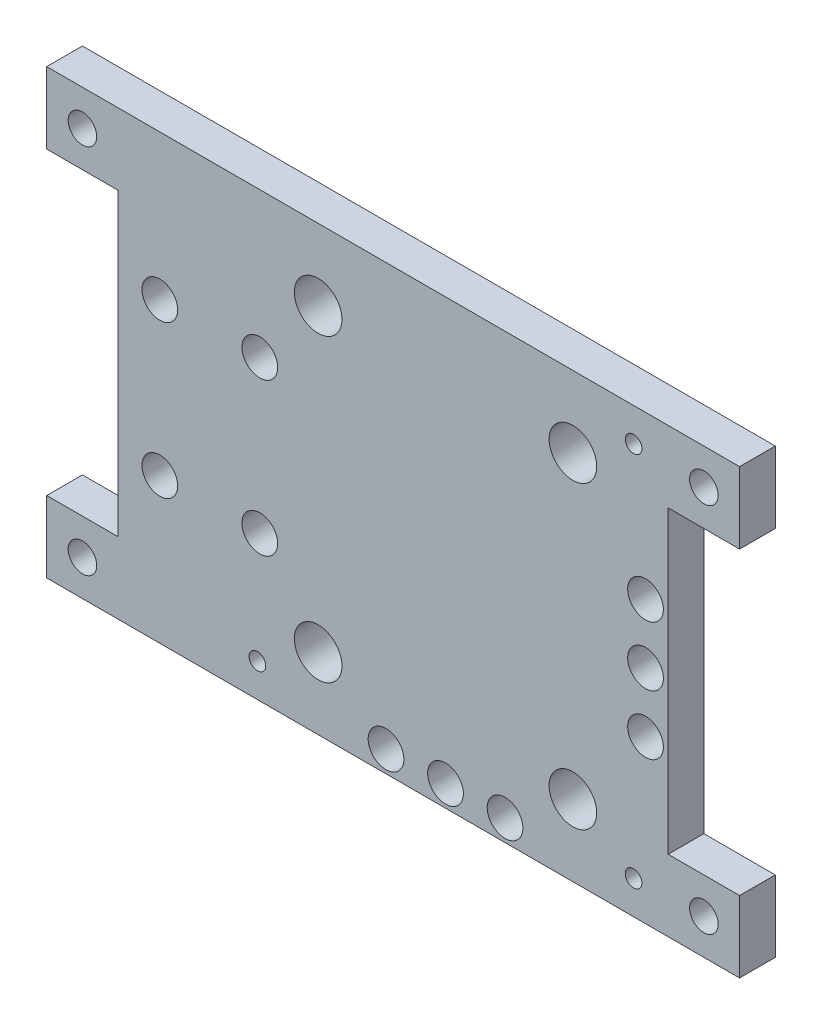
from build123d import *

# Parameters (mm, degrees)
SKETCH_1_W          = 23.1
SKETCH_1_H          = 18.6
EXTRUDE_1_DEPTH     = 1.5
SKETCH_2_R          = 0.75
SKETCH_2_R_2        = 1
SKETCH_2_R_3        = 0.35
CUT_EXTRUDE_1_DEPTH = 15.904445646
SKETCH_3_W          = 3
SKETCH_3_H          = 3
SKETCH_3_R          = 0.6
EXTRUDE_2_DEPTH     = 1.5


with BuildPart() as part:
    # 草图1 → 凸台-拉伸1 (new body)
    with BuildSketch(Plane.XY):
        Rectangle(SKETCH_1_W, SKETCH_1_H)
    extrude(amount=EXTRUDE_1_DEPTH)

    # 草图2 → 切除-拉伸1 (cut, through all)
    with BuildSketch(Plane(origin=(0, 0, 0), x_dir=(-1, 0, 0), z_dir=(0, 0, -1))):
        with Locations((-10.6, 2.5)):
            Circle(SKETCH_2_R)
        with Locations((-10.6, 0)):
            Circle(SKETCH_2_R)
        with Locations((-10.6, -2.5)):
            Circle(SKETCH_2_R)
        with Locations((-7.55, -6.3)):
            Circle(SKETCH_2_R_2)
        with Locations((3.15, -6.3)):
            Circle(SKETCH_2_R_2)
        with Locations((-4.7, -8.4)):
            Circle(SKETCH_2_R)
        with Locations((-2.2, -8.4)):
            Circle(SKETCH_2_R)
        with Locations((0.3, -8.4)):
            Circle(SKETCH_2_R)
        with Locations((-7.55, 6.3)):
            Circle(SKETCH_2_R_2)
        with Locations((3.15, 6.3)):
            Circle(SKETCH_2_R_2)
        with Locations((5.6, 3.2)):
            Circle(SKETCH_2_R)
        with Locations((9.8, 3.2)):
            Circle(SKETCH_2_R)
        with Locations((5.6, -3.2)):
            Circle(SKETCH_2_R)
        with Locations((9.8, -3.2)):
            Circle(SKETCH_2_R)
        with Locations((5.7, -7.9)):
            Circle(SKETCH_2_R_3)
        with Locations((-10.1, -7.9)):
            Circle(SKETCH_2_R_3)
        with Locations((-10.1, 7.9)):
            Circle(SKETCH_2_R_3)
    extrude(amount=-CUT_EXTRUDE_1_DEPTH, mode=Mode.SUBTRACT)

    # 草图3 → 凸台-拉伸2 (add)
    # profile 1 of 4: a face of its own
    with BuildSketch(Plane(origin=(0, 0, 0), x_dir=(-1, 0, 0), z_dir=(0, 0, -1))):
        with Locations((-13.05, 7.8)):
            Rectangle(SKETCH_3_W, SKETCH_3_H)
        with Locations((-13.05, 7.8)):
            Circle(SKETCH_3_R, mode=Mode.SUBTRACT)
    # profile 2 of 4: a face of its own
    with BuildSketch(Plane(origin=(0, 0, 0), x_dir=(-1, 0, 0), z_dir=(0, 0, -1))):
        with Locations((-13.05, -7.8)):
            Rectangle(SKETCH_3_W, SKETCH_3_H)
        with Locations((-13.05, -7.8)):
            Circle(SKETCH_3_R, mode=Mode.SUBTRACT)
    # profile 3 of 4: a face of its own
    with BuildSketch(Plane(origin=(0, 0, 0), x_dir=(-1, 0, 0), z_dir=(0, 0, -1))):
        with Locations((13.05, 7.8)):
            Rectangle(SKETCH_3_W, SKETCH_3_H)
        with Locations((13.05, 7.8)):
            Circle(SKETCH_3_R, mode=Mode.SUBTRACT)
    # profile 4 of 4: a face of its own
    with BuildSketch(Plane(origin=(0, 0, 0), x_dir=(-1, 0, 0), z_dir=(0, 0, -1))):
        with Locations((13.05, -7.8)):
            Rectangle(SKETCH_3_W, SKETCH_3_H)
        with Locations((13.05, -7.8)):
            Circle(SKETCH_3_R, mode=Mode.SUBTRACT)
    extrude(amount=-EXTRUDE_2_DEPTH)


solid = part.part
